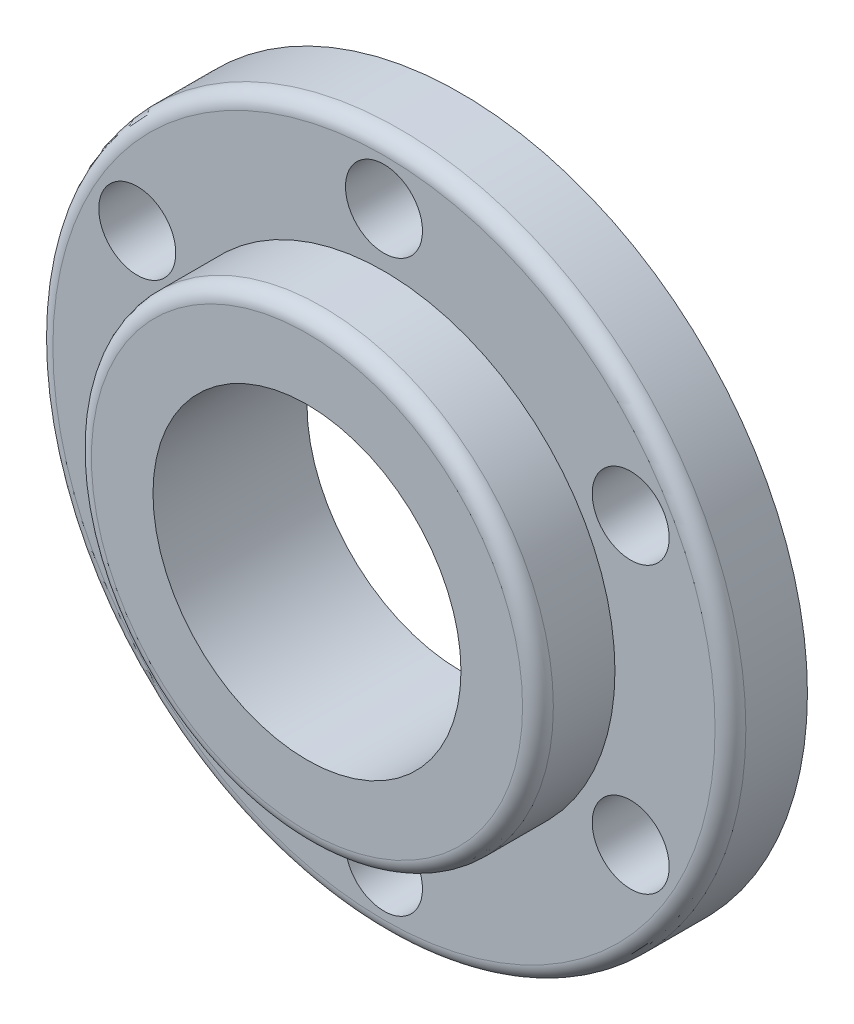
from build123d import *

# Parameters (mm, degrees)
SKETCH1_R           = 45
SKETCH1_R_2         = 5
SKETCH1_R_3         = 30
BOSS_EXTRUDE1_DEPTH = 10
SKETCH1_3_R         = 30
SKETCH1_3_R_2       = 20
BOSS_EXTRUDE2_DEPTH = 20
FILLET1_R           = 2
SCALE_1_SCALE       = 0.135064935


with BuildPart() as part:
    # Sketch1 → Boss-Extrude1 (new body)
    with BuildSketch(Plane.XY):
        Circle(SKETCH1_R)
        with Locations((0, -37)):
            Circle(SKETCH1_R_2, mode=Mode.SUBTRACT)
        with Locations((-32.04293994, -18.5)):
            Circle(SKETCH1_R_2, mode=Mode.SUBTRACT)
        with Locations((32.04293994, -18.5)):
            Circle(SKETCH1_R_2, mode=Mode.SUBTRACT)
        with Locations((-32.04293994, 18.5)):
            Circle(SKETCH1_R_2, mode=Mode.SUBTRACT)
        Circle(SKETCH1_R_3, mode=Mode.SUBTRACT)
        with Locations((32.04293994, 18.5)):
            Circle(SKETCH1_R_2, mode=Mode.SUBTRACT)
        with Locations((0, 37)):
            Circle(SKETCH1_R_2, mode=Mode.SUBTRACT)
    extrude(amount=BOSS_EXTRUDE1_DEPTH)

    # Sketch1<3> → Boss-Extrude2 (add)
    with BuildSketch(Plane.XY):
        Circle(SKETCH1_3_R)
        Circle(SKETCH1_3_R_2, mode=Mode.SUBTRACT)
    extrude(amount=BOSS_EXTRUDE2_DEPTH)

    # Fillet1
    fillet1_edges = [part.edges().sort_by_distance(p)[0] for p in [
        (-45, 0, 10),
        (-30, 0, 20),
    ]]
    fillet(fillet1_edges, radius=FILLET1_R)


with BuildPart() as part_1:
    # 缩放比例1: scaled about (0, 0, 7.492696154)
    add(part.part.scale(SCALE_1_SCALE).moved(Location((0, 0, 6.480695634))))


solid = part_1.part
